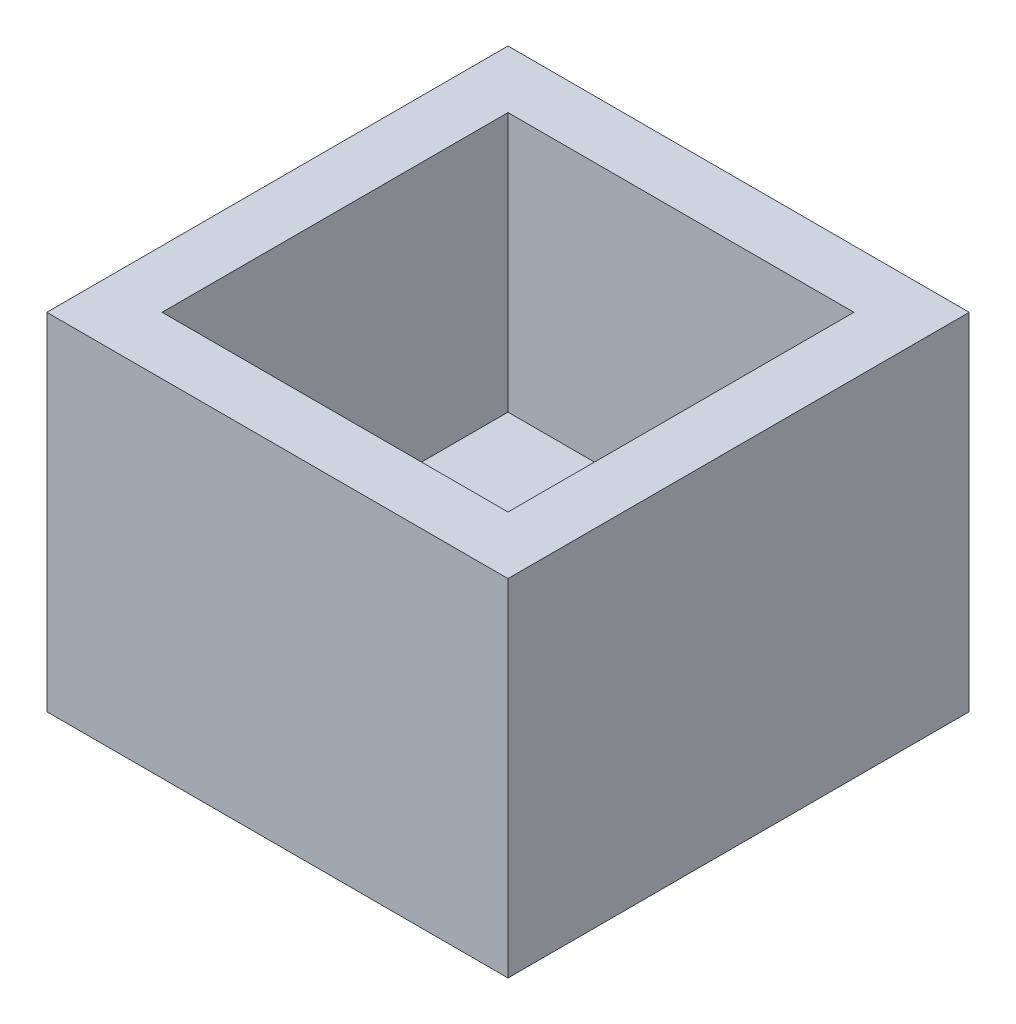
from build123d import *

# Parameters (mm, degrees)
SKETCH1_W           = 101.6
SKETCH1_H           = 101.6
BOSS_EXTRUDE1_DEPTH = 76.2
SKETCH3_W           = 76.2
SKETCH3_H           = 76.2
CUT_EXTRUDE2_DEPTH  = 57.15


with BuildPart() as part:
    # Sketch1 → Boss-Extrude1 (new body)
    with BuildSketch(Plane(origin=(0, 0, 0), x_dir=(1, 0, 0), z_dir=(0, 1, 0))):
        Rectangle(SKETCH1_W, SKETCH1_H)
    extrude(amount=BOSS_EXTRUDE1_DEPTH)

    # Sketch3 → Cut-Extrude2 (cut)
    with BuildSketch(Plane(origin=(0, 76.2, 0), x_dir=(1, 0, 0), z_dir=(0, 1, 0))):
        Rectangle(SKETCH3_W, SKETCH3_H)
    extrude(amount=-CUT_EXTRUDE2_DEPTH, mode=Mode.SUBTRACT)


solid = part.part
